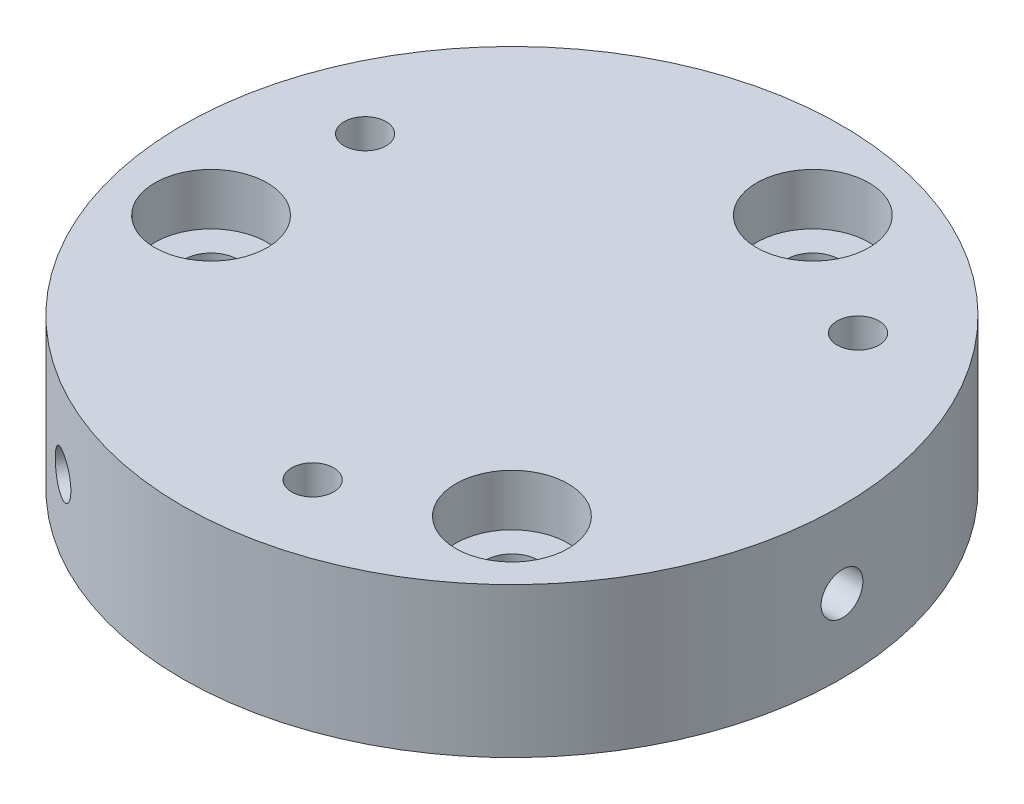
from build123d import *

# Parameters (mm, degrees)
SKETCH1_R                                      = 13.97
BOSS_EXTRUDE1_DEPTH                            = 6.35
CBORE_FOR_2_SOCKET_HEAD_CAP_SCREW1_D           = 2.2606
CBORE_FOR_2_SOCKET_HEAD_CAP_SCREW1_CBORE_D     = 4.7625
CBORE_FOR_2_SOCKET_HEAD_CAP_SCREW1_CBORE_DEPTH = 2.1844
CIRPATTERN1_COUNT                              = 3
CIRPATTERN2_COUNT                              = 3
CIRPATTERN3_COUNT                              = 3


with BuildPart() as part:
    # Sketch1 → Boss-Extrude1 (new body)
    with BuildSketch(Plane(origin=(0, 0, 0), x_dir=(1, 0, 0), z_dir=(0, 1, 0))):
        with Locations(Location((0, 0, 0), (0, 0, 270))):
            Circle(SKETCH1_R)
    extrude(amount=BOSS_EXTRUDE1_DEPTH)

    # CBORE for #2 Socket Head Cap Screw1 (through all)
    with Locations(Plane(origin=(0, 6.35, 0), x_dir=(1, 0, 0), z_dir=(0, 1, 0))):
        with Locations((7.363810019, -7.363810019)):
            cbore_for_2_socket_head_cap_screw1 = CounterBoreHole(CBORE_FOR_2_SOCKET_HEAD_CAP_SCREW1_D / 2, CBORE_FOR_2_SOCKET_HEAD_CAP_SCREW1_CBORE_D / 2, CBORE_FOR_2_SOCKET_HEAD_CAP_SCREW1_CBORE_DEPTH)

    # CirPattern1: CBORE for #2 Socket Head Cap Screw1 ×3 about axis
    cirpattern1_axis = Axis((0, 0, 0), (0, 1, 0))
    for i in range(1, CIRPATTERN1_COUNT):
        add(cbore_for_2_socket_head_cap_screw1.rotate(cirpattern1_axis, i * 360 / CIRPATTERN1_COUNT), mode=Mode.SUBTRACT)

    # Sketch10 → Tap Drill for #2-56 Tap2 (revolve, cut)
    with BuildSketch(Plane(origin=(7.977586831, 6.35, -6.693990167), x_dir=(0, 0, 1), z_dir=(1, 0, 0))):
        Polygon((0, 0), (0, 4.59816509), (0.889, 4.064), (0.889, 0), align=None)
    tap_drill_for_2_56_tap2 = revolve(axis=Axis((7.977586831, 12.7, -6.693990167), (0, -1, 0)), mode=Mode.SUBTRACT)

    # CirPattern2: Tap Drill for #2-56 Tap2 ×3 about axis
    cirpattern2_axis = Axis((0, 0, 0), (0, 1, 0))
    for i in range(1, CIRPATTERN2_COUNT):
        add(tap_drill_for_2_56_tap2.rotate(cirpattern2_axis, i * 360 / CIRPATTERN2_COUNT), mode=Mode.SUBTRACT)

    # Sketch15 → Tap Drill for #2-56 Tap1 (revolve, cut)
    with BuildSketch(Plane(origin=(-6.942501454, 3.105629072, 12.122812114), x_dir=(0.8677746681735182, 0, 0.4969578707258195), z_dir=(0, 1, 0))):
        Polygon((0, 0), (0, 7.095959572), (0.889, 6.35), (0.889, 0), align=None)
    tap_drill_for_2_56_tap1 = revolve(axis=Axis((-10.098183933, 3.105629072, 17.633181257), (0.4969578707258195, 0, -0.8677746681735182)), mode=Mode.SUBTRACT)

    # CirPattern3: Tap Drill for #2-56 Tap1 ×3 about axis
    cirpattern3_axis = Axis((0, 6.35, 0), (0, -1, 0))
    for i in range(1, CIRPATTERN3_COUNT):
        add(tap_drill_for_2_56_tap1.rotate(cirpattern3_axis, i * 360 / CIRPATTERN3_COUNT), mode=Mode.SUBTRACT)


solid = part.part
